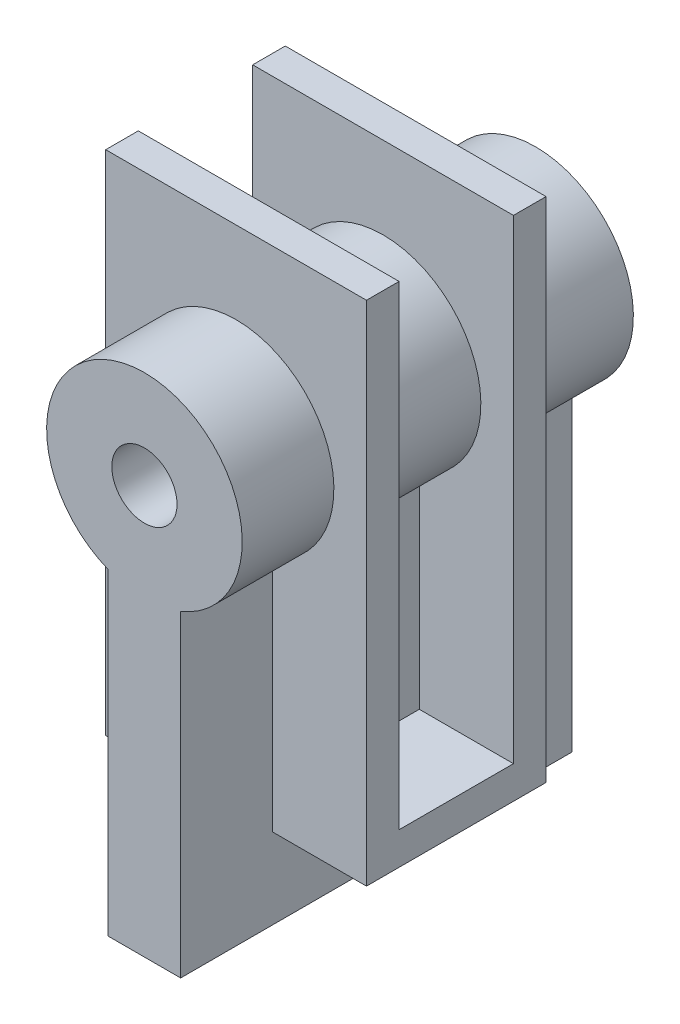
from build123d import *

# Parameters (mm, degrees)
EXTRUDE_5_DEPTH      = 30
EXTRUDE_5_DEPTH_BACK = 30
F_1_FR_R             = 5
EXTRUDE_6_DEPTH      = 20
EXTRUDE_6_DEPTH_BACK = 20


with BuildPart() as part:
    # Эскиз1_fr → Бобышка-Вытянуть5 (new, two sides: drawn at the far end of the back side and taken through both)
    with BuildSketch(Plane.XY.offset(-EXTRUDE_5_DEPTH_BACK)):
        with BuildLine():
            Line((-5.557606452, -13.932444528), (-5.557606452, -62.642280008))
            Line((-5.557606452, -62.642280008), (5.557606452, -62.642280008))
            Line((5.557606452, -62.642280008), (5.557606452, -13.932444528))
            ThreePointArc((5.557606452, -13.932444528), (0, 15), (-5.557606452, -13.932444528))
        make_face()
        Circle(F_1_FR_R, mode=Mode.SUBTRACT)
    extrude(amount=EXTRUDE_5_DEPTH + EXTRUDE_5_DEPTH_BACK)


with BuildPart() as body_2:
    # Эскиз3 → Бобышка-Вытянуть6 (new, two sides: drawn at the far end of the back side and taken through both)
    with BuildSketch(Plane(origin=(0, 0, 0), x_dir=(0, 0, -1), z_dir=(1, 0, 0)).offset(-EXTRUDE_6_DEPTH_BACK)):
        Polygon((-58.394498043, -50.25314581), (-85.938130262, -50.25314581), (-85.938130262, 27.580465306), (-80.938130262, 27.580465306), (-80.938130262, -45.25314581), (-63.394498043, -45.25314581), (-63.394498043, 27.580465306), (-58.394498043, 27.580465306), align=None)
    extrude(amount=EXTRUDE_6_DEPTH + EXTRUDE_6_DEPTH_BACK)


with BuildPart() as body_2_1:
    # Move Body 1: moved
    add(body_2.part.moved(Location((0, 0, -70))))


with BuildPart() as part_1:
    add(part.part)

    # Combine 1: union body 2
    add(body_2_1.part)


solid = part_1.part
